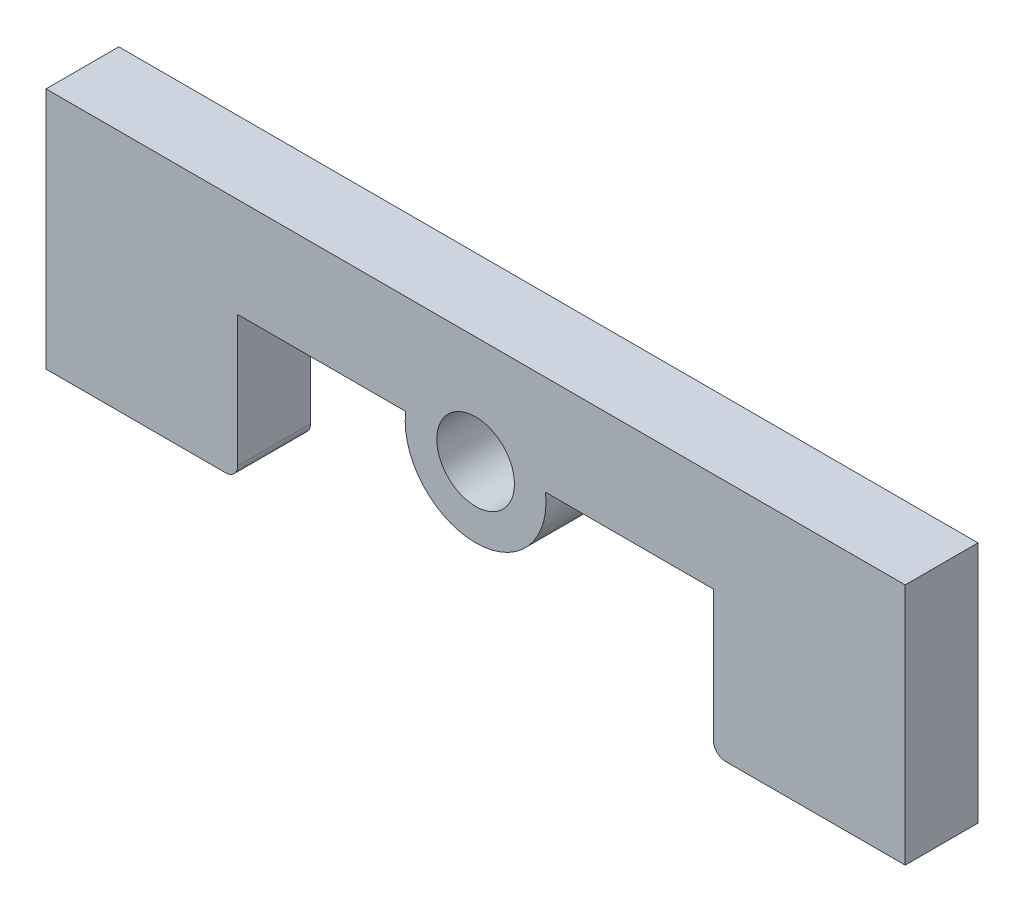
from build123d import *

# Parameters (mm, degrees)
SKETCH2_R           = 1.6
BOSS_EXTRUDE2_DEPTH = 3
FILLET1_R           = 2.5
FILLET2_R           = 0.5


with BuildPart() as part:
    # Sketch2 → Boss-Extrude2 (new body)
    with BuildSketch(Plane.XY):
        with BuildLine():
            Line((9.8, 0.9), (9.8, -5))
            Line((9.8, -5), (17.7, -5))
            Line((17.7, -5), (17.7, 5))
            Line((17.7, 5), (-17.7, 5))
            Line((-17.7, 5), (-17.7, -5))
            Line((-17.7, -5), (-9.8, -5))
            Line((-9.8, -5), (-9.8, 0.9))
            Line((-9.8, 0.9), (-2.878801834, 0.9))
            ThreePointArc((-2.878801834, 0.9), (0, -2.35), (2.878801834, 0.9))
            Line((2.878801834, 0.9), (9.8, 0.9))
        make_face()
        with Locations((0, 0.55)):
            Circle(SKETCH2_R, mode=Mode.SUBTRACT)
    extrude(amount=BOSS_EXTRUDE2_DEPTH)

    # Fillet1
    fillet1_edges = [part.edges().sort_by_distance(p)[0] for p in [
        (-6.339400917, 0.9, 0),
        (6.339400917, 0.9, 0),
    ]]
    fillet(fillet1_edges, radius=FILLET1_R)

    # Fillet2
    fillet2_edges = [part.edges().sort_by_distance(p)[0] for p in [
        (-9.8, -5, 1.5),
        (9.8, -5, 1.5),
    ]]
    fillet(fillet2_edges, radius=FILLET2_R)


solid = part.part
